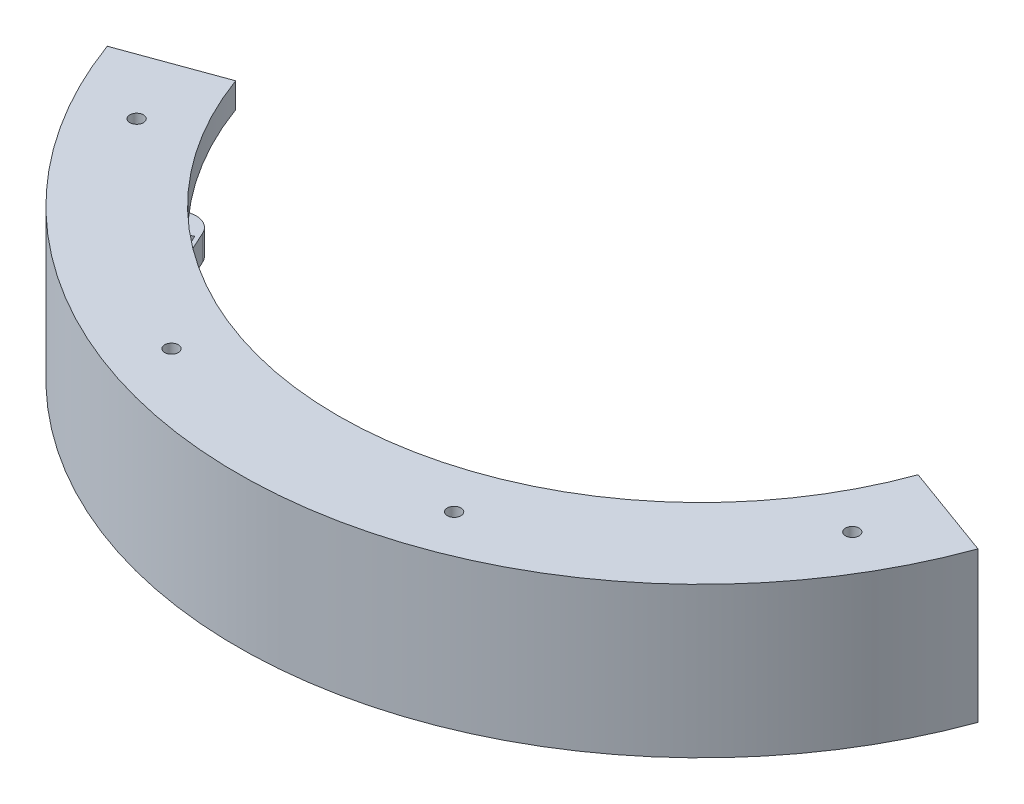
from build123d import *

# Parameters (mm, degrees)
BOSS_EXTRUDE1_DEPTH = 38.1
SKETCH4_W           = 19.05
SKETCH4_H           = 25.4
CUT_EXTRUDE1_START  = -6.35
CUT_EXTRUDE1_DEPTH  = 6.35
CIRPATTERN1_COUNT   = 13
CIRPATTERN1_ANGLE   = 140
CIRPATTERN2_COUNT   = 4
CIRPATTERN2_ANGLE   = 120
SKETCH13_W          = 4.452036414
SKETCH13_H          = 6.35
CUT_REVOLVE2_ANGLE  = 145
FILLET1_R           = 5.08


with BuildPart() as part:
    # Sketch1 → Boss-Extrude1 (new body)
    with BuildSketch(Plane(origin=(0, 0, 0), x_dir=(1, 0, 0), z_dir=(0, 1, 0))):
        with BuildLine():
            Line((-110.390390627, -40.178816337), (-86.522198059, -31.491504697))
            ThreePointArc((-86.522198059, -31.491504697), (0, -92.075), (86.522198059, -31.491504697))
            Line((86.522198059, -31.491504697), (110.390390627, -40.178816337))
            ThreePointArc((110.390390627, -40.178816337), (0, -117.475), (-110.390390627, -40.178816337))
        make_face()
    extrude(amount=-BOSS_EXTRUDE1_DEPTH)

    # Sketch4 → Cut-Revolve1 (revolve, cut)
    with BuildSketch(Plane(origin=(86.522198059, 0, 31.491504697), x_dir=(0.9396926207859084, 0, 0.34202014332566905), z_dir=(-0.34202014332566905, 0, 0.9396926207859084))):
        with Locations((9.525, -19.05)):
            Rectangle(SKETCH4_W, SKETCH4_H)
    revolve(axis=Axis((0, -38.1, 0), (0, 1, 0)), mode=Mode.SUBTRACT)

    # Sketch5 → Cut-Extrude1 (cut)
    with BuildSketch(Plane(origin=(0, -31.75, 0), x_dir=(1, 0, 0), z_dir=(0, 1, 0)).offset(CUT_EXTRUDE1_START)):
        Polygon((98.301392685, -45.398059752), (88.621295381, -40.60893497), (86.049357998, -45.807505744), (95.729455302, -50.596630526), align=None)
    cut_extrude1 = extrude(amount=CUT_EXTRUDE1_DEPTH, mode=Mode.SUBTRACT)

    # CirPattern1: Cut-Extrude1 ×13 about axis
    cirpattern1_axis = Axis((0, 0, 0), (0, -1, 0))
    for i in range(1, CIRPATTERN1_COUNT):
        add(cut_extrude1.rotate(cirpattern1_axis, i * CIRPATTERN1_ANGLE / (CIRPATTERN1_COUNT - 1)), mode=Mode.SUBTRACT)

    # Sketch11 → #8-32 Tapped Hole1 (revolve, cut)
    with BuildSketch(Plane(origin=(90.737811682, 0, 52.3875), x_dir=(0, 0, 1), z_dir=(1, 0, 0))):
        Polygon((0, 0), (0, 11.705806461), (1.7272, 10.668), (1.7272, 0), align=None)
    f_8_32_tapped_hole1 = revolve(axis=Axis((90.737811682, 6.35, 52.3875), (0, -1, 0)), mode=Mode.SUBTRACT)

    # CirPattern2: #8-32 Tapped Hole1 ×4 about axis
    cirpattern2_axis = Axis((0, 0, 0), (0, -1, 0))
    for i in range(1, CIRPATTERN2_COUNT):
        add(f_8_32_tapped_hole1.rotate(cirpattern2_axis, i * CIRPATTERN2_ANGLE / (CIRPATTERN2_COUNT - 1)), mode=Mode.SUBTRACT)

    # Sketch13 → Cut-Revolve2 (revolve, cut)
    with BuildSketch(Plane(origin=(0, 0, 0), x_dir=(-0.9396926207859083, 0, -0.3420201433256694), z_dir=(0.3420201433256694, 0, -0.9396926207859083))):
        with Locations((-94.301018207, -34.925)):
            Rectangle(SKETCH13_W, SKETCH13_H)
    revolve(axis=Axis((0, -38.1, 0), (0, -1, 0)), revolution_arc=CUT_REVOLVE2_ANGLE, mode=Mode.SUBTRACT)

    # Fillet1
    fillet1_edges = [part.edges().sort_by_distance(p)[0] for p in [
        (-90.705743825, -34.925, 33.014190829),
        (90.705743825, -34.925, 33.014190829),
    ]]
    fillet(fillet1_edges, radius=FILLET1_R)


solid = part.part
